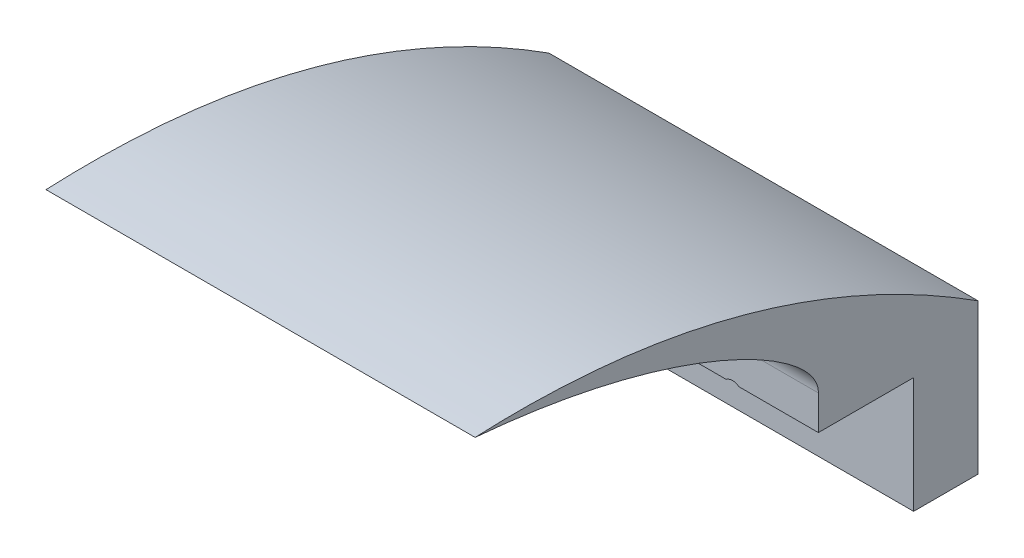
from build123d import *

# Parameters (mm, degrees)
BOSS_EXTRUDE1_DEPTH     = 63.5
CUT_EXTRUDE1_DEPTH      = 168.419011538
CUT_EXTRUDE1_DEPTH_BACK = 168.419011538
SKETCH2_R               = 3.175


with BuildPart() as part:
    # Sketch1 → Boss-Extrude1 (new, symmetric)
    with BuildSketch(Plane(origin=(0, 0, 0), x_dir=(0, 0, -1), z_dir=(1, 0, 0))):
        with BuildLine():
            Line((0.809260665, 1.527522938), (0.809260665, -8.632477062))
            Line((0.809260665, -8.632477062), (29.003260665, -8.632477062))
            Line((29.003260665, -8.632477062), (29.003260665, -42.922477062))
            Line((29.003260665, -42.922477062), (48.053260665, -42.922477062))
            Line((48.053260665, -42.922477062), (48.053260665, 1.527522938))
            add(Edge.make_bspline(
                [(-100.790739335, 40.936245598), (-19.432334381, 44.723152192), (48.053260665, 1.527522938)],
                knots=[0, 0, 0, 1, 1, 1], degree=2))
            add(Edge.make_bspline(
                [(-100.790739335, 40.936245598), (-95.812000817, 40.506536715), (-85.404095735, 39.35609048), (-70.04704926, 36.825372047), (-55.204457945, 33.455234316), (-41.848670928, 29.540032245), (-30.135862863, 25.255462099), (-20.192126341, 20.775035432), (-12.11168478, 16.271531389), (-5.930472237, 11.904209881), (-1.681652897, 7.768063044), (0.491896357, 4.287160304), (0.81175974, 2.163002008), (0.809260665, 1.527522938)],
                knots=[0.35379081, 0.35379081, 0.35379081, 0.35379081, 0.374279703, 0.396711254, 0.417576734, 0.436654006, 0.45374439, 0.468679994, 0.481329415, 0.491630702, 0.499615789, 0.505546281, 0.508115399, 0.508115399, 0.508115399, 0.508115399], degree=3))
        make_face()
    extrude(amount=BOSS_EXTRUDE1_DEPTH, both=True)

    # Sketch2 → Cut-Extrude1 (cut, two sides: drawn at the far end of the back side and taken through both)
    with BuildSketch(Plane(origin=(0, 0, -48.053260665), x_dir=(-1, 0, 0), z_dir=(0, 0, -1)).offset(-CUT_EXTRUDE1_DEPTH_BACK)):
        with Locations(Location((-38.1, -11.172477062, 0), (0, 0, 53.130102354))):
            Circle(SKETCH2_R)
        with Locations(Location((38.1, -11.172477062, 0), (0, 0, 53.130102354))):
            Circle(SKETCH2_R)
    extrude(amount=CUT_EXTRUDE1_DEPTH + CUT_EXTRUDE1_DEPTH_BACK, mode=Mode.SUBTRACT)


solid = part.part
